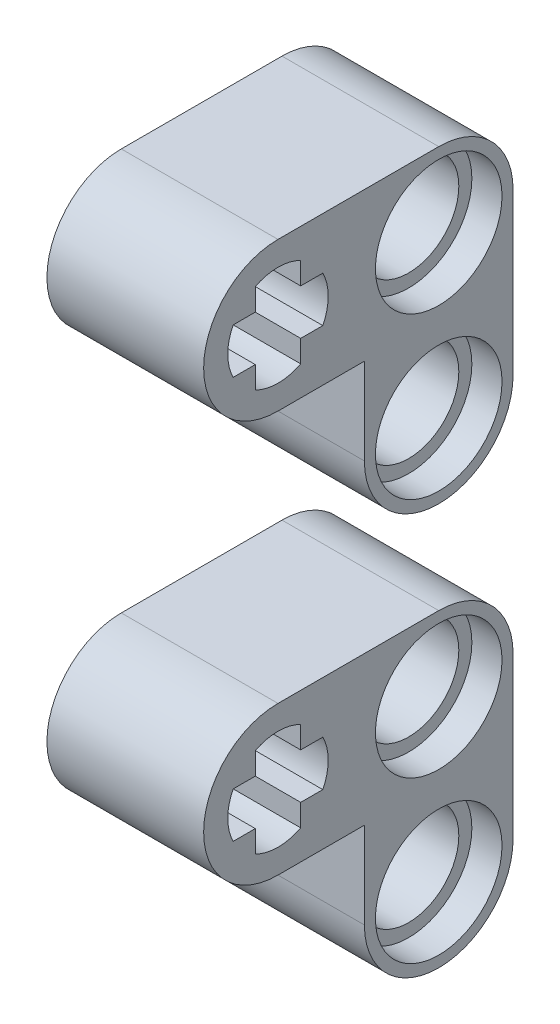
from build123d import *

# Parameters (mm, degrees)
EXTRUDE_1_DEPTH        = 7.8
SKETCH_1_3_R           = 2.5
CUT_EXTRUDE_1_DEPTH    = 19.292621463
SKETCH_1_4_R           = 3.15
CUT_EXTRUDE_2_DEPTH    = 1.5
CUT_EXTRUDE_START      = 6.3
SKETCH_1_5_R           = 3.15
CUT_EXTRUDE_3_DEPTH    = 1.5
PATTERN_LINEAR_1_COUNT = 2
PATTERN_LINEAR_1_PITCH = 20


with BuildPart() as part:
    # 草图1 → 凸台-拉伸1 (new body)
    with BuildSketch(Plane(origin=(0, 0, 0), x_dir=(0, 0, -1), z_dir=(1, 0, 0))):
        with BuildLine():
            Line((11.7, -8), (11.7, 0))
            ThreePointArc((11.7, 0), (10.61629509, 2.61629509), (8, 3.7))
            Line((8, 3.7), (0, 3.7))
            ThreePointArc((0, 3.7), (-3.7, 0), (0, -3.7))
            Line((0, -3.7), (4.3, -3.7))
            Line((4.3, -3.7), (4.3, -8))
            ThreePointArc((4.3, -8), (8, -11.7), (11.7, -8))
        make_face()
    extrude(amount=EXTRUDE_1_DEPTH)

    # 草图1<3> → 切除-拉伸1 (cut, through all)
    with BuildSketch(Plane(origin=(0, 0, 0), x_dir=(0, 0, -1), z_dir=(1, 0, 0))):
        with BuildLine():
            ThreePointArc((-2.230029762, 1.130029762), (-2.5, 0), (-2.230029762, -1.130029762))
            Line((-2.230029762, -1.130029762), (-1.130029762, -1.130029762))
            Line((-1.130029762, -1.130029762), (-1.130029762, -2.230029762))
            ThreePointArc((-1.130029762, -2.230029762), (0, -2.5), (1.130029762, -2.230029762))
            Line((1.130029762, -2.230029762), (1.130029762, -1.130029762))
            Line((1.130029762, -1.130029762), (2.230029762, -1.130029762))
            ThreePointArc((2.230029762, -1.130029762), (2.5, 0), (2.230029762, 1.130029762))
            Line((2.230029762, 1.130029762), (1.130029762, 1.130029762))
            Line((1.130029762, 1.130029762), (1.130029762, 2.230029762))
            ThreePointArc((1.130029762, 2.230029762), (0, 2.5), (-1.130029762, 2.230029762))
            Line((-1.130029762, 2.230029762), (-1.130029762, 1.130029762))
            Line((-1.130029762, 1.130029762), (-2.230029762, 1.130029762))
        make_face()
        with Locations((8, 0)):
            Circle(SKETCH_1_3_R)
        with Locations((8, -8)):
            Circle(SKETCH_1_3_R)
    extrude(amount=CUT_EXTRUDE_1_DEPTH, mode=Mode.SUBTRACT)

    # 草图1<4> → 切除-拉伸2 (cut)
    with BuildSketch(Plane(origin=(0, 0, 0), x_dir=(0, 0, -1), z_dir=(1, 0, 0))):
        with Locations((8, 0)):
            Circle(SKETCH_1_4_R)
        with Locations((8, -8)):
            Circle(SKETCH_1_4_R)
    extrude(amount=CUT_EXTRUDE_2_DEPTH, mode=Mode.SUBTRACT)

    # 草图1<5> → 切除-拉伸3 (cut)
    with BuildSketch(Plane(origin=(0, 0, 0), x_dir=(0, 0, -1), z_dir=(1, 0, 0)).offset(CUT_EXTRUDE_START)):
        with Locations((8, 0)):
            Circle(SKETCH_1_5_R)
        with Locations((8, -8)):
            Circle(SKETCH_1_5_R)
    extrude(amount=CUT_EXTRUDE_3_DEPTH, mode=Mode.SUBTRACT)


with BuildPart() as pattern_linear_1_1:
    # 阵列(线性)1: pattern copy
    add(part.part.moved(Location(Vector(0, 1, 0) * (1 * PATTERN_LINEAR_1_PITCH))))


solid = Compound([part.part, pattern_linear_1_1.part])
